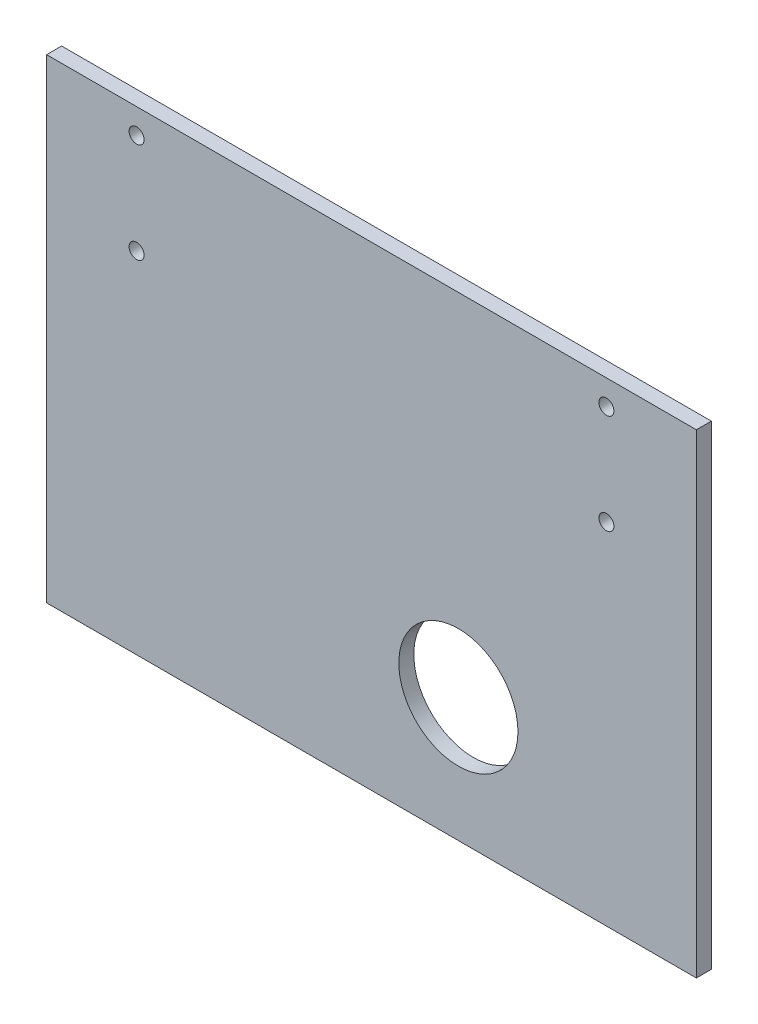
from build123d import *

# Parameters (mm, degrees)
SKETCH_1_W          = 130
SKETCH_1_H          = 95
EXTRUDE_1_DEPTH     = 3
SKETCH_2_R          = 1.5
SKETCH_2_R_2        = 11.922228354
CUT_EXTRUDE_1_DEPTH = 4


with BuildPart() as part:
    # 草图1 → 凸台-拉伸1 (new body)
    with BuildSketch(Plane.XY):
        Rectangle(SKETCH_1_W, SKETCH_1_H)
    extrude(amount=EXTRUDE_1_DEPTH)

    # 草图2 → 切除-拉伸1 (cut)
    with BuildSketch(Plane.XY.offset(3)):
        with Locations((-47, 42.5)):
            Circle(SKETCH_2_R)
        with Locations((-47, 22.5)):
            Circle(SKETCH_2_R)
        with Locations((47, 42.5)):
            Circle(SKETCH_2_R)
        with Locations((47, 22.5)):
            Circle(SKETCH_2_R)
        with Locations((17.382680584, -22.677378789)):
            Circle(SKETCH_2_R_2)
    extrude(amount=-CUT_EXTRUDE_1_DEPTH, mode=Mode.SUBTRACT)


solid = part.part
